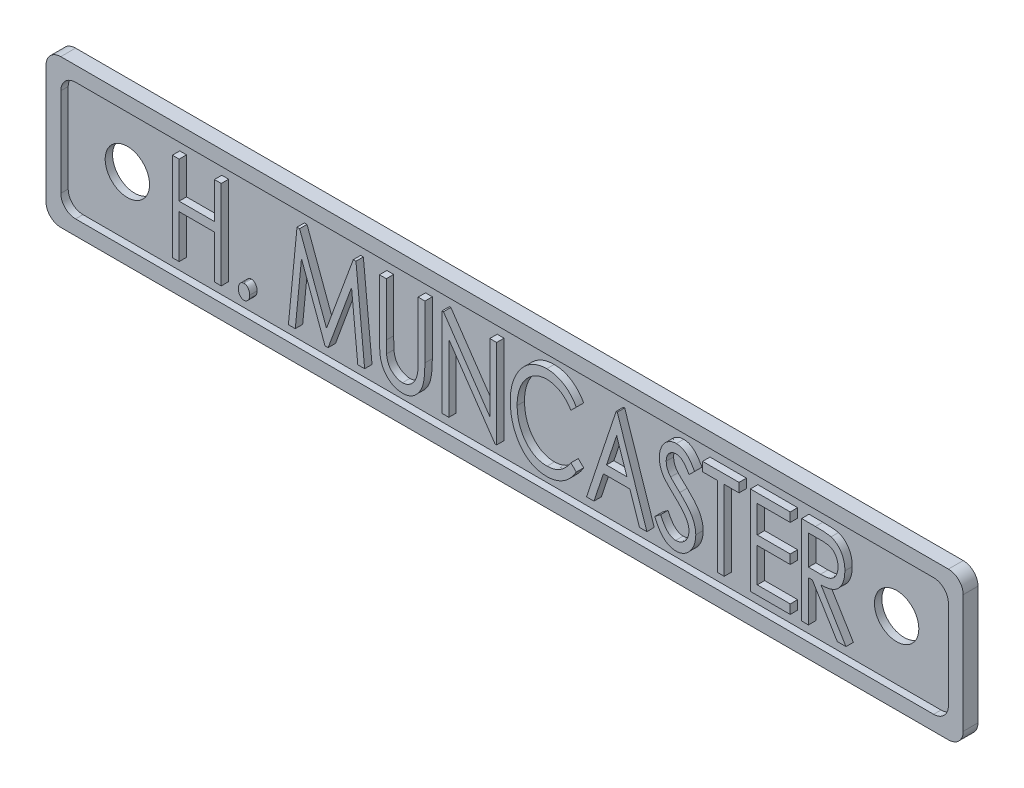
from build123d import *

# Parameters (mm, degrees)
SKETCH1_W           = 62
SKETCH1_H           = 10
BOSS_EXTRUDE1_DEPTH = 1
SKETCH2_W           = 60
SKETCH2_H           = 8
CUT_EXTRUDE2_DEPTH  = 0.5
FILLET1_R           = 1
SKETCH3_R           = 1.5
CUT_EXTRUDE3_DEPTH  = 32.404617495
BOSS_EXTRUDE2_DEPTH = 0.5


with BuildPart() as part:
    # Sketch1 → Boss-Extrude1 (new body)
    with BuildSketch(Plane.XY):
        Rectangle(SKETCH1_W, SKETCH1_H)
    extrude(amount=BOSS_EXTRUDE1_DEPTH)

    # Sketch2 → Cut-Extrude2 (cut)
    with BuildSketch(Plane.XY.offset(1)):
        Rectangle(SKETCH2_W, SKETCH2_H)
    extrude(amount=-CUT_EXTRUDE2_DEPTH, mode=Mode.SUBTRACT)

    # Fillet1
    fillet1_edges = [part.edges().sort_by_distance(p)[0] for p in [
        (-30, -4, 0.75),
        (-30, 4, 0.75),
        (30, 4, 0.75),
        (30, -4, 0.75),
        (31, -5, 0.5),
        (-31, -5, 0.5),
        (-31, 5, 0.5),
        (31, 5, 0.5),
    ]]
    fillet(fillet1_edges, radius=FILLET1_R)

    # Sketch3 → Cut-Extrude3 (cut, through all)
    with BuildSketch(Plane.XY.offset(0.5)):
        with Locations((-26, 0)):
            Circle(SKETCH3_R)
        with Locations((26, 0)):
            Circle(SKETCH3_R)
    extrude(amount=-CUT_EXTRUDE3_DEPTH, mode=Mode.SUBTRACT)

    # Sketch4 → Boss-Extrude2 (add)
    # profile 1 of 11: a face of its own
    with BuildSketch(Plane.XY.offset(0.5)):
        Polygon((-22.461538462, 3), (-22, 3), (-22, 0.538461538), (-19.615384615, 0.538461538), (-19.615384615, 3), (-19.153846154, 3), (-19.153846154, -3), (-19.615384615, -3), (-19.615384615, -0.076923077), (-22, -0.076923077), (-22, -3), (-22.461538462, -3), align=None)
    # profile 2 of 11: a face of its own
    with BuildSketch(Plane.XY.offset(0.5)):
        with BuildLine():
            add(Edge.make_bspline(
                [(-17.615384615, -2.076923077), (-17.589523185, -2.078902905), (-17.538413725, -2.082815602), (-17.464748755, -2.110549271), (-17.39885129, -2.158171278), (-17.340759852, -2.222042391), (-17.292381222, -2.298212427), (-17.255082191, -2.383449815), (-17.234973259, -2.477844229), (-17.232200947, -2.543180967), (-17.230769231, -2.576923077)],
                knots=[0, 0, 0, 0, 0.888235515, 1.755403159, 2.664739847, 3.658771767, 4.705496901, 5.754303631, 6.840246125, 8, 8, 8, 8], degree=3))
            add(Edge.make_bspline(
                [(-17.230769231, -2.576923077), (-17.232254955, -2.609856645), (-17.2351656, -2.674375934), (-17.255021795, -2.768027162), (-17.29272864, -2.853415577), (-17.34037106, -2.930423423), (-17.398845736, -2.994568624), (-17.465010677, -3.0417811), (-17.538137985, -3.071369126), (-17.589478624, -3.075060464), (-17.615384615, -3.076923077)],
                knots=[0, 0, 0, 0, 1.133833385, 2.221263238, 3.271506465, 4.33130329, 5.326696684, 6.237278843, 7.110547914, 8, 8, 8, 8], degree=3))
            add(Edge.make_bspline(
                [(-17.615384615, -3.076923077), (-17.641303381, -3.075078426), (-17.692669338, -3.071422686), (-17.765915396, -3.041441341), (-17.833068344, -2.995030779), (-17.891461073, -2.930320983), (-17.939555281, -2.853727008), (-17.975399848, -2.767709895), (-17.995705045, -2.674419681), (-17.998548548, -2.609871429), (-18, -2.576923077)],
                knots=[0, 0, 0, 0, 0.888790314, 1.761409654, 2.682617918, 3.677270718, 4.73627903, 5.78038943, 6.867010211, 8, 8, 8, 8], degree=3))
            add(Edge.make_bspline(
                [(-18, -2.576923077), (-17.998603819, -2.543165638), (-17.995900314, -2.47779922), (-17.975339373, -2.383767098), (-17.939896786, -2.297903738), (-17.891073182, -2.222143956), (-17.833063326, -2.157709118), (-17.766180246, -2.110882317), (-17.692393737, -2.082761588), (-17.641258892, -2.078884757), (-17.615384615, -2.076923077)],
                knots=[0, 0, 0, 0, 1.158892172, 2.244027806, 3.286711158, 4.33265857, 5.32595192, 6.245901114, 7.112424448, 8, 8, 8, 8], degree=3))
        make_face()
    # profile 3 of 11: a face of its own
    with BuildSketch(Plane.XY.offset(0.5)):
        Polygon((-14.615384615, -3), (-14.032451923, 3), (-13.858173077, 3), (-12.038461538, -1.923076923), (-10.229567308, 3), (-10.048076923, 3), (-9.461538462, -3), (-9.924278846, -3), (-10.346153846, 1.307692308), (-11.927884615, -3), (-12.139423077, -3), (-13.730769231, 1.307692308), (-14.149038462, -3), align=None)
    # profile 4 of 11: a face of its own
    with BuildSketch(Plane.XY.offset(0.5)):
        with BuildLine():
            Line((-8.461538462, 3), (-8, 3))
            Line((-8, 3), (-8, -0.594951923))
            add(Edge.make_bspline(
                [(-8, -0.594951923), (-8.000137495, -0.645834144), (-8.000398416, -0.742391927), (-7.998655639, -0.879805245), (-7.998137006, -1.002019622), (-7.99512821, -1.109370744), (-7.993503517, -1.201566002), (-7.989274728, -1.27884447), (-7.98662248, -1.341061559), (-7.982527713, -1.3774164), (-7.980769231, -1.393028846)],
                knots=[0, 0, 0, 0, 1.529155413, 2.901835916, 4.130035505, 5.201918895, 6.129357308, 6.900801451, 7.527953438, 8, 8, 8, 8], degree=3))
            add(Edge.make_bspline(
                [(-7.980769231, -1.393028846), (-7.974178758, -1.449279787), (-7.961420618, -1.558172948), (-7.926355429, -1.71304453), (-7.88078902, -1.854178607), (-7.823474755, -1.982212702), (-7.749339971, -2.09757866), (-7.66021953, -2.202984272), (-7.552331475, -2.296944374), (-7.431939254, -2.381338153), (-7.301612345, -2.449755674), (-7.168784847, -2.501181563), (-7.035153432, -2.533002518), (-6.945676503, -2.53665559), (-6.901442308, -2.538461538)],
                knots=[0, 0, 0, 0, 1.17424895, 2.273165188, 3.287688819, 4.247239277, 5.174089139, 6.123362021, 7.100708873, 8.13362008, 9.16716642, 10.145784664, 11.083342199, 12, 12, 12, 12], degree=3))
            add(Edge.make_bspline(
                [(-6.901442308, -2.538461538), (-6.8632915, -2.536600844), (-6.786732183, -2.532866888), (-6.673041068, -2.51006617), (-6.562996497, -2.468985143), (-6.455369113, -2.415309392), (-6.354681143, -2.345686788), (-6.260493786, -2.264433995), (-6.176764107, -2.169949747), (-6.100579167, -2.064564295), (-6.032296085, -1.947571639), (-5.977648421, -1.817143176), (-5.927538315, -1.676866468), (-5.905565237, -1.577631242), (-5.894230769, -1.526442308)],
                knots=[0, 0, 0, 0, 0.887425244, 1.780844861, 2.682628156, 3.611715659, 4.570365192, 5.521242685, 6.497608697, 7.498294315, 8.541734898, 9.639015203, 10.782123018, 12, 12, 12, 12], degree=3))
            add(Edge.make_bspline(
                [(-5.894230769, -1.526442308), (-5.890532745, -1.505225969), (-5.882252611, -1.457721106), (-5.870823297, -1.378508585), (-5.865456572, -1.284040949), (-5.856896475, -1.175193637), (-5.853587773, -1.051270492), (-5.847287465, -0.912314967), (-5.847648464, -0.758405521), (-5.846666705, -0.651038854), (-5.846153846, -0.594951923)],
                knots=[0, 0, 0, 0, 0.553535321, 1.239404254, 2.05518318, 2.983939725, 4.045295254, 5.240417841, 6.558430678, 8, 8, 8, 8], degree=3))
            Line((-5.846153846, -0.594951923), (-5.846153846, 3))
            Line((-5.846153846, 3), (-5.384615385, 3))
            Line((-5.384615385, 3), (-5.384615385, -0.623798077))
            add(Edge.make_bspline(
                [(-5.384615385, -0.623798077), (-5.38528543, -0.689103398), (-5.386592798, -0.816524872), (-5.390706739, -1.003310098), (-5.40053154, -1.180434271), (-5.413770468, -1.347940148), (-5.429842012, -1.505625441), (-5.452453668, -1.653675146), (-5.475228042, -1.792762014), (-5.513587996, -1.963278499), (-5.575515123, -2.164765659), (-5.684005206, -2.390209525), (-5.822657153, -2.599595214), (-5.960080099, -2.759638646), (-6.08446528, -2.873404912), (-6.183437428, -2.948264791), (-6.286950676, -3.012484522), (-6.395739817, -3.064585564), (-6.509237604, -3.103863151), (-6.626944492, -3.133464539), (-6.749921372, -3.150150635), (-6.833686184, -3.152601958), (-6.876201923, -3.153846154)],
                knots=[0, 0, 0, 0, 1.189495296, 2.320901874, 3.402429694, 4.419879292, 5.381225388, 6.288312168, 7.147249289, 7.947424288, 9.470551633, 10.975160932, 12.486972232, 14.033533548, 14.803182079, 15.553316057, 16.290454294, 17.018287978, 17.745243254, 18.474392565, 19.22566139, 20, 20, 20, 20], degree=3))
            add(Edge.make_bspline(
                [(-6.876201923, -3.153846154), (-6.922310733, -3.152512708), (-7.012788636, -3.149896129), (-7.146504518, -3.134526276), (-7.274502105, -3.10632353), (-7.398555728, -3.069726332), (-7.516127199, -3.019332597), (-7.630249214, -2.961303818), (-7.737044111, -2.888690022), (-7.840589424, -2.809252733), (-7.936150502, -2.718912232), (-8.024403917, -2.621400746), (-8.103728743, -2.516003243), (-8.176131723, -2.40480951), (-8.238805867, -2.285384684), (-8.294153074, -2.159932324), (-8.339881568, -2.026608737), (-8.363961059, -1.934861218), (-8.376201923, -1.888221154)],
                knots=[0, 0, 0, 0, 1.040046564, 2.040851474, 3.029716458, 3.992945491, 4.952778378, 5.910567797, 6.875363504, 7.860382118, 8.851185287, 9.836411077, 10.823085881, 11.82307474, 12.825469039, 13.861228841, 14.912750729, 16, 16, 16, 16], degree=3))
            add(Edge.make_bspline(
                [(-8.376201923, -1.888221154), (-8.383450837, -1.856251541), (-8.399210765, -1.78674612), (-8.4147017, -1.672108701), (-8.429106965, -1.540262589), (-8.440907694, -1.390743312), (-8.450239523, -1.224033241), (-8.457706267, -1.039724576), (-8.460816331, -0.837751411), (-8.461291001, -0.69711583), (-8.461538462, -0.623798077)],
                knots=[0, 0, 0, 0, 0.619449711, 1.346751184, 2.18483435, 3.12705977, 4.181588362, 5.341301494, 6.613936809, 8, 8, 8, 8], degree=3))
            Line((-8.461538462, -0.623798077), (-8.461538462, 3))
        make_face()
    # profile 5 of 11: a face of its own
    with BuildSketch(Plane.XY.offset(0.5)):
        Polygon((-4.230769231, -3), (-4.230769231, 3), (-4.133413462, 3), (-1, -1.575721154), (-1, 3), (-0.538461538, 3), (-0.538461538, -3), (-0.643028846, -3), (-3.769230769, 1.563701923), (-3.769230769, -3), align=None)
    # profile 6 of 11: a face of its own
    with BuildSketch(Plane.XY.offset(0.5)):
        with BuildLine():
            Line((4.846153846, 1.899038462), (4.480769231, 1.538461538))
            add(Edge.make_bspline(
                [(4.480769231, 1.538461538), (4.429931322, 1.616561786), (4.3308393, 1.768792902), (4.158110639, 1.972241305), (3.968988292, 2.144505444), (3.766301532, 2.287134283), (3.55137635, 2.400553458), (3.324082284, 2.479812403), (3.086740523, 2.530095581), (2.924530278, 2.535652854), (2.842548077, 2.538461538)],
                knots=[0, 0, 0, 0, 1.111525425, 2.166558491, 3.175351395, 4.157123073, 5.11752335, 6.065846558, 7.022465223, 8, 8, 8, 8], degree=3))
            add(Edge.make_bspline(
                [(2.842548077, 2.538461538), (2.797212982, 2.537774402), (2.707020468, 2.53640737), (2.573355511, 2.518121748), (2.442120014, 2.492503193), (2.313604234, 2.454512697), (2.187934147, 2.406503418), (2.063840468, 2.348447678), (1.943323714, 2.278585488), (1.825336308, 2.19949288), (1.71294198, 2.110515496), (1.605840877, 2.014112162), (1.50447161, 1.911364627), (1.412069376, 1.799229561), (1.323845773, 1.68206814), (1.243173522, 1.556085289), (1.169021304, 1.423186808), (1.101583117, 1.283514123), (1.041889112, 1.138072662), (0.98849271, 0.988393345), (0.945492549, 0.833133876), (0.909724333, 0.673833973), (0.880549111, 0.510281183), (0.860214225, 0.34216998), (0.847940135, 0.169658553), (0.846752921, 0.052904904), (0.846153846, -0.006009615)],
                knots=[0, 0, 0, 0, 0.907615735, 1.805668338, 2.698251542, 3.584750363, 4.486668963, 5.391547429, 6.326439657, 7.274845802, 8.235134492, 9.19572507, 10.160699102, 11.123701377, 12.104602389, 13.09764599, 14.118208251, 15.152161779, 16.20308195, 17.26679937, 18.334114781, 19.428523801, 20.537059719, 21.661122186, 22.819789684, 24, 24, 24, 24], degree=3))
            add(Edge.make_bspline(
                [(0.846153846, -0.006009615), (0.847448527, -0.094639647), (0.849986004, -0.268347877), (0.879369803, -0.522871973), (0.922180588, -0.766502418), (0.987307935, -0.998375634), (1.066883647, -1.220102237), (1.16629433, -1.430335383), (1.282887633, -1.629393357), (1.417076772, -1.814446736), (1.563860333, -1.983892322), (1.722273027, -2.132225304), (1.891040135, -2.257334297), (2.068276401, -2.360126455), (2.255334436, -2.440826423), (2.452232418, -2.496267655), (2.658070221, -2.533244942), (2.798713371, -2.536703698), (2.870192308, -2.538461538)],
                knots=[0, 0, 0, 0, 1.176544319, 2.305938824, 3.398675503, 4.458528894, 5.500492725, 6.524019327, 7.54247104, 8.560018829, 9.555640471, 10.515690316, 11.436249321, 12.339796262, 13.231324186, 14.133993287, 15.051641147, 16, 16, 16, 16], degree=3))
            add(Edge.make_bspline(
                [(2.870192308, -2.538461538), (2.948958689, -2.535547666), (3.104715858, -2.529785606), (3.332997247, -2.481006923), (3.551459921, -2.402373868), (3.759782598, -2.291813862), (3.9571635, -2.14914771), (4.143937844, -1.975378831), (4.321884979, -1.771220961), (4.426641212, -1.61775704), (4.480769231, -1.538461538)],
                knots=[0, 0, 0, 0, 0.952744079, 1.884010888, 2.812241363, 3.756054432, 4.729234272, 5.752103472, 6.83850172, 8, 8, 8, 8], degree=3))
            Line((4.480769231, -1.538461538), (4.846153846, -1.895432692))
            add(Edge.make_bspline(
                [(4.846153846, -1.895432692), (4.817435647, -1.944238724), (4.76047853, -2.041036259), (4.66688777, -2.178651707), (4.568009542, -2.30773199), (4.464147929, -2.428587047), (4.355355923, -2.541364137), (4.240539277, -2.645406886), (4.120189507, -2.740159049), (3.995319665, -2.827075786), (3.865915047, -2.903681306), (3.732620703, -2.97049546), (3.595508241, -3.026758164), (3.454745603, -3.074029998), (3.310059383, -3.110209365), (3.161327842, -3.135017815), (3.009183426, -3.151433127), (2.906292828, -3.153038896), (2.854567308, -3.153846154)],
                knots=[0, 0, 0, 0, 1.097466587, 2.176617458, 3.223542499, 4.24784203, 5.263894416, 6.259075414, 7.248787007, 8.231127996, 9.20607359, 10.161176055, 11.11880108, 12.076583544, 13.037195505, 14.006246386, 14.997693222, 16, 16, 16, 16], degree=3))
            add(Edge.make_bspline(
                [(2.854567308, -3.153846154), (2.805250995, -3.153393918), (2.707633851, -3.152498758), (2.563676577, -3.138118673), (2.423446123, -3.118431756), (2.287628084, -3.088832873), (2.154920694, -3.053955194), (2.027216003, -3.006742792), (1.902355729, -2.955240052), (1.782485485, -2.89254157), (1.665973676, -2.823496092), (1.55381454, -2.744736652), (1.445835865, -2.657976953), (1.340778761, -2.564023388), (1.23978061, -2.461892497), (1.14350397, -2.351038074), (1.051954552, -2.231288775), (0.994418188, -2.147300001), (0.965144231, -2.104567308)],
                knots=[0, 0, 0, 0, 1.046396854, 2.071247165, 3.068337592, 4.050812492, 5.020504577, 5.978187628, 6.938585804, 7.885712413, 8.846901056, 9.811882422, 10.792109303, 11.785857194, 12.802202964, 13.839086606, 14.90054771, 16, 16, 16, 16], degree=3))
            add(Edge.make_bspline(
                [(0.965144231, -2.104567308), (0.918541385, -2.029597556), (0.824993365, -1.87910735), (0.708280504, -1.638687561), (0.607759495, -1.387786621), (0.526335945, -1.12522486), (0.462546092, -0.851283965), (0.416943159, -0.566172703), (0.390546358, -0.269330136), (0.386616184, -0.067760604), (0.384615385, 0.034855769)],
                knots=[0, 0, 0, 0, 0.941762336, 1.890442552, 2.848217964, 3.824856944, 4.82179242, 5.84833146, 6.904614102, 8, 8, 8, 8], degree=3))
            add(Edge.make_bspline(
                [(0.384615385, 0.034855769), (0.386460088, 0.142730192), (0.390083455, 0.354617137), (0.425490568, 0.665389179), (0.478168597, 0.963555323), (0.555733534, 1.24806321), (0.654241253, 1.520218061), (0.775984001, 1.778539997), (0.91859145, 2.024634672), (1.082086034, 2.254643762), (1.261561486, 2.465035875), (1.454459805, 2.649364571), (1.659529168, 2.804659843), (1.875158821, 2.933161365), (2.102889696, 3.032686644), (2.341668008, 3.102133671), (2.5913582, 3.145732602), (2.761838287, 3.151110525), (2.848557692, 3.153846154)],
                knots=[0, 0, 0, 0, 1.169859921, 2.297838878, 3.38909346, 4.451914606, 5.49279678, 6.52526877, 7.545842673, 8.574575139, 9.582520364, 10.541746408, 11.463212457, 12.367418115, 13.258904221, 14.15150219, 15.059710529, 16, 16, 16, 16], degree=3))
            add(Edge.make_bspline(
                [(2.848557692, 3.153846154), (2.901080829, 3.153024907), (3.005164255, 3.151397468), (3.159424939, 3.135271791), (3.309593304, 3.108928089), (3.455999208, 3.072256119), (3.59928106, 3.027589922), (3.737412026, 2.969135046), (3.871637051, 2.901172023), (4.002515952, 2.824704471), (4.128435584, 2.73809138), (4.248972221, 2.643011346), (4.362964348, 2.53936659), (4.472073473, 2.428104533), (4.574905008, 2.308493159), (4.671652854, 2.179775145), (4.76290522, 2.043409118), (4.818242825, 1.947442053), (4.846153846, 1.899038462)],
                knots=[0, 0, 0, 0, 1.015828107, 2.013034202, 2.996775397, 3.9630177, 4.931247519, 5.897116707, 6.860744174, 7.840446603, 8.827236464, 9.81499991, 10.808221994, 11.805759373, 12.828042674, 13.85735367, 14.919298219, 16, 16, 16, 16], degree=3))
        make_face()
    # profile 7 of 11: a face of its own
    with BuildSketch(Plane.XY.offset(0.5)):
        Polygon((7.615384615, 3), (9.615384615, -3), (9.112980769, -3), (8.472355769, -1.076923077), (6.681490385, -1.076923077), (6.040865385, -3), (5.538461538, -3), (7.538461538, 3), align=None)
        Polygon((7.576923077, 1.608173077), (6.887019231, -0.461538462), (8.266826923, -0.461538462), align=None, mode=Mode.SUBTRACT)
    # profile 8 of 11: a face of its own
    with BuildSketch(Plane.XY.offset(0.5)):
        with BuildLine():
            Line((10.153846154, -1.842548077), (10.548076923, -1.538461538))
            add(Edge.make_bspline(
                [(10.548076923, -1.538461538), (10.584196754, -1.61715141), (10.652811988, -1.766635053), (10.768187005, -1.970960886), (10.887905727, -2.144551544), (11.012953708, -2.286762579), (11.142161445, -2.398662125), (11.276339259, -2.479028342), (11.416385395, -2.529380901), (11.51242981, -2.53544965), (11.560096154, -2.538461538)],
                knots=[0, 0, 0, 0, 1.383911973, 2.628955942, 3.746738872, 4.749501891, 5.649278085, 6.467738257, 7.239546467, 8, 8, 8, 8], degree=3))
            add(Edge.make_bspline(
                [(11.560096154, -2.538461538), (11.60031061, -2.536944344), (11.680817483, -2.533907013), (11.798990083, -2.506105661), (11.913722476, -2.462585888), (12.022077261, -2.401041146), (12.123338479, -2.325789556), (12.212288578, -2.236308635), (12.289169897, -2.135527194), (12.351169763, -2.023363672), (12.39968046, -1.903637435), (12.436512332, -1.779850019), (12.457153373, -1.65173338), (12.460064171, -1.565374532), (12.461538462, -1.521634615)],
                knots=[0, 0, 0, 0, 0.957025484, 1.915906269, 2.876875915, 3.872777538, 4.875201359, 5.874300986, 6.869103784, 7.886329657, 8.918145261, 9.94233607, 10.957813246, 12, 12, 12, 12], degree=3))
            add(Edge.make_bspline(
                [(12.461538462, -1.521634615), (12.459202698, -1.471822319), (12.454490422, -1.37132875), (12.423919319, -1.221837166), (12.371355036, -1.074105587), (12.322115684, -0.980616129), (12.296875, -0.932692308)],
                knots=[0, 0, 0, 0, 0.966966069, 1.9508009, 2.949555883, 4, 4, 4, 4], degree=3))
            add(Edge.make_bspline(
                [(12.296875, -0.932692308), (12.276376695, -0.898429227), (12.233682171, -0.827064989), (12.159961585, -0.719512024), (12.072446985, -0.60854705), (11.976003151, -0.49033056), (11.865313453, -0.369540021), (11.745586787, -0.241259114), (11.611966784, -0.109928379), (11.51818831, -0.021464357), (11.469951923, 0.024038462)],
                knots=[0, 0, 0, 0, 0.755051921, 1.572646229, 2.463860742, 3.427272442, 4.457417882, 5.561650114, 6.745797563, 8, 8, 8, 8], degree=3))
            add(Edge.make_bspline(
                [(11.469951923, 0.024038462), (11.421647043, 0.069072626), (11.328994379, 0.155451792), (11.199949066, 0.282882643), (11.084033478, 0.399368072), (10.982695679, 0.506084421), (10.896667695, 0.60388404), (10.821972902, 0.689544956), (10.764398476, 0.767835995), (10.732171188, 0.81757513), (10.717548077, 0.840144231)],
                knots=[0, 0, 0, 0, 1.424520873, 2.732346164, 3.911797783, 4.969453705, 5.906063081, 6.721610001, 7.419931359, 8, 8, 8, 8], degree=3))
            add(Edge.make_bspline(
                [(10.717548077, 0.840144231), (10.678173932, 0.910874382), (10.600026302, 1.051255682), (10.520696599, 1.278112419), (10.469843847, 1.512949587), (10.464326851, 1.672809616), (10.461538462, 1.753605769)],
                knots=[0, 0, 0, 0, 1.010002809, 2.004597808, 2.991487604, 4, 4, 4, 4], degree=3))
            add(Edge.make_bspline(
                [(10.461538462, 1.753605769), (10.463420897, 1.817009533), (10.467132555, 1.942024742), (10.4954085, 2.12496143), (10.540846367, 2.299721372), (10.6054957, 2.463977502), (10.687438606, 2.615352621), (10.782718971, 2.752832067), (10.896919653, 2.870181018), (11.022171002, 2.971598294), (11.159477152, 3.051670677), (11.302870763, 3.112104818), (11.453534866, 3.146409995), (11.555526101, 3.151352913), (11.606971154, 3.153846154)],
                knots=[0, 0, 0, 0, 1.134028395, 2.235999694, 3.303558056, 4.359136636, 5.385468439, 6.377922891, 7.341187669, 8.305065693, 9.252924554, 10.175426404, 11.07967301, 12, 12, 12, 12], degree=3))
            add(Edge.make_bspline(
                [(11.606971154, 3.153846154), (11.662112625, 3.151425898), (11.771941237, 3.146605328), (11.933065173, 3.103663898), (12.087304275, 3.03351581), (12.21077971, 2.954537631), (12.306830259, 2.875259006), (12.381819821, 2.804376199), (12.455603097, 2.720180319), (12.53328214, 2.627098074), (12.609176739, 2.520203541), (12.689285706, 2.404191354), (12.767953663, 2.275169127), (12.819541395, 2.184826175), (12.846153846, 2.138221154)],
                knots=[0, 0, 0, 0, 1.175486554, 2.34128787, 3.531861235, 4.78213163, 5.45670903, 6.188699625, 6.982072091, 7.845002107, 8.775633155, 9.779069424, 10.854293392, 12, 12, 12, 12], degree=3))
            Line((12.846153846, 2.138221154), (12.467548077, 1.769230769))
            add(Edge.make_bspline(
                [(12.467548077, 1.769230769), (12.445859778, 1.807101782), (12.404117283, 1.879990418), (12.338427767, 1.981620917), (12.277806548, 2.074519662), (12.218774824, 2.156992284), (12.161046541, 2.228559433), (12.107077926, 2.291601354), (12.055923386, 2.344937228), (11.990411201, 2.400495524), (11.908406218, 2.456016731), (11.804656712, 2.504047977), (11.696234584, 2.532646717), (11.62235912, 2.536520299), (11.585336538, 2.538461538)],
                knots=[0, 0, 0, 0, 1.277082512, 2.457943285, 3.540954167, 4.523791102, 5.424804978, 6.231190945, 6.952616042, 7.584745617, 8.7425584, 9.83919577, 10.917116091, 12, 12, 12, 12], degree=3))
            add(Edge.make_bspline(
                [(11.585336538, 2.538461538), (11.53850119, 2.536313647), (11.447178147, 2.532125529), (11.318105477, 2.487787522), (11.202857829, 2.417148289), (11.104354492, 2.32074856), (11.023671383, 2.205258616), (10.96543582, 2.074315432), (10.929716144, 1.93056356), (10.925330238, 1.830338214), (10.923076923, 1.778846154)],
                knots=[0, 0, 0, 0, 0.99611477, 1.942298585, 2.874789164, 3.86028234, 4.861081634, 5.863631982, 6.902413458, 8, 8, 8, 8], degree=3))
            add(Edge.make_bspline(
                [(10.923076923, 1.778846154), (10.926593813, 1.714897222), (10.933637793, 1.586813884), (10.974395913, 1.428558772), (11.027551569, 1.304545017), (11.079451991, 1.206355618), (11.146489215, 1.105369134), (11.197888106, 1.038542798), (11.224759615, 1.003605769)],
                knots=[0, 0, 0, 0, 1.355548403, 2.715028404, 3.434297335, 4.213120542, 5.065813534, 6, 6, 6, 6], degree=3))
            add(Edge.make_bspline(
                [(11.224759615, 1.003605769), (11.234628004, 0.99185234), (11.258166256, 0.963817859), (11.303189664, 0.919356003), (11.360218318, 0.861826149), (11.430553573, 0.793128438), (11.513539402, 0.711815495), (11.611416113, 0.621031017), (11.721832846, 0.517498213), (11.800055322, 0.444685312), (11.841346154, 0.40625)],
                knots=[0, 0, 0, 0, 0.428692003, 1.022523547, 1.766726267, 2.693054975, 3.769890224, 5.013497286, 6.423532597, 8, 8, 8, 8], degree=3))
            add(Edge.make_bspline(
                [(11.841346154, 0.40625), (11.891239461, 0.358797393), (11.988142063, 0.26663511), (12.125695564, 0.12877509), (12.249546361, -0.006670294), (12.362673809, -0.136626496), (12.462715788, -0.263814512), (12.552270438, -0.385620318), (12.628269646, -0.505042742), (12.712057411, -0.656990556), (12.796245895, -0.844976006), (12.869182858, -1.072591181), (12.914573261, -1.30107922), (12.920257344, -1.454128342), (12.923076923, -1.530048077)],
                knots=[0, 0, 0, 0, 1.084434174, 2.106184132, 3.066299982, 3.974504037, 4.819036384, 5.614179407, 6.354614465, 7.046545079, 8.345825613, 9.591028967, 10.805034351, 12, 12, 12, 12], degree=3))
            add(Edge.make_bspline(
                [(12.923076923, -1.530048077), (12.921907715, -1.583776281), (12.919597469, -1.689938207), (12.901698589, -1.846522538), (12.86957233, -1.99732187), (12.828192367, -2.143752174), (12.772463838, -2.284350781), (12.705064948, -2.419579898), (12.624951706, -2.548765826), (12.534838036, -2.671248161), (12.435804024, -2.783788118), (12.330087723, -2.883192586), (12.218036893, -2.966134845), (12.101330464, -3.034656264), (11.979037492, -3.087857568), (11.851255607, -3.126420247), (11.718025706, -3.150081939), (11.627500393, -3.152582081), (11.581730769, -3.153846154)],
                knots=[0, 0, 0, 0, 1.104469644, 2.182329142, 3.233937398, 4.27141944, 5.306905159, 6.338287977, 7.373773695, 8.428087969, 9.460949709, 10.451670126, 11.405478766, 12.320888455, 13.22829632, 14.140290566, 15.059730392, 16, 16, 16, 16], degree=3))
            add(Edge.make_bspline(
                [(11.581730769, -3.153846154), (11.546418072, -3.152953137), (11.475899779, -3.151169813), (11.371861107, -3.135868842), (11.269621886, -3.113869485), (11.170893248, -3.078853878), (11.07338981, -3.037650537), (10.979124102, -2.985142272), (10.887519384, -2.923567058), (10.798091004, -2.852237537), (10.710618592, -2.769627418), (10.625915833, -2.674079263), (10.540990307, -2.56748701), (10.461622191, -2.445774605), (10.380123567, -2.314046694), (10.303084937, -2.167991594), (10.225261924, -2.010612199), (10.17812927, -1.899694007), (10.153846154, -1.842548077)],
                knots=[0, 0, 0, 0, 0.820449022, 1.638409663, 2.440521417, 3.24753877, 4.069361106, 4.898905185, 5.751347498, 6.632806319, 7.555188638, 8.544456245, 9.599041491, 10.720130119, 11.919714617, 13.198980023, 14.556892339, 16, 16, 16, 16], degree=3))
        make_face()
    # profile 9 of 11: a face of its own
    with BuildSketch(Plane.XY.offset(0.5)):
        Polygon((13.384615385, 2.384615385), (13.384615385, 3), (15.846153846, 3), (15.846153846, 2.384615385), (14.846153846, 2.384615385), (14.846153846, -3), (14.384615385, -3), (14.384615385, 2.384615385), align=None)
    # profile 10 of 11: a face of its own
    with BuildSketch(Plane.XY.offset(0.5)):
        Polygon((16.615384615, 3), (19.307692308, 3), (19.307692308, 2.384615385), (17.076923077, 2.384615385), (17.076923077, 0.538461538), (19.307692308, 0.538461538), (19.307692308, -0.076923077), (17.076923077, -0.076923077), (17.076923077, -2.384615385), (19.307692308, -2.384615385), (19.307692308, -3), (16.615384615, -3), align=None)
    # profile 11 of 11: a face of its own
    with BuildSketch(Plane.XY.offset(0.5)):
        with BuildLine():
            Line((20.076923077, 3), (21.008413462, 3))
            add(Edge.make_bspline(
                [(21.008413462, 3), (21.070512309, 2.999739407), (21.189513223, 2.99924003), (21.360659509, 2.996303005), (21.516054556, 2.988241168), (21.656065, 2.98112552), (21.779770395, 2.968252346), (21.888240269, 2.956099977), (21.98104025, 2.939734308), (22.036934684, 2.925005828), (22.0625, 2.918269231)],
                knots=[0, 0, 0, 0, 1.406291012, 2.694895705, 3.875596585, 4.929939196, 5.86881668, 6.691431991, 7.401479668, 8, 8, 8, 8], degree=3))
            add(Edge.make_bspline(
                [(22.0625, 2.918269231), (22.096402168, 2.907317385), (22.164277265, 2.885390833), (22.261195077, 2.840666397), (22.353273811, 2.786915549), (22.441506829, 2.726191192), (22.523267522, 2.654408024), (22.600283497, 2.574376624), (22.67435529, 2.486972179), (22.740382233, 2.389464403), (22.802664123, 2.286340838), (22.8549611, 2.175741572), (22.899417117, 2.059487718), (22.937404714, 1.938135783), (22.964097186, 1.810363813), (22.984620834, 1.677189747), (22.998625091, 1.538357661), (22.999537177, 1.44354424), (23, 1.395432692)],
                knots=[0, 0, 0, 0, 0.890219086, 1.782296258, 2.662026138, 3.55410331, 4.45596999, 5.376940187, 6.329934089, 7.316405561, 8.318020235, 9.33962404, 10.370274173, 11.428642517, 12.515222745, 13.630246086, 14.797506457, 16, 16, 16, 16], degree=3))
            add(Edge.make_bspline(
                [(23, 1.395432692), (22.998150067, 1.315578002), (22.994553355, 1.160321363), (22.960105156, 0.93492605), (22.903946176, 0.724192299), (22.824939882, 0.529420861), (22.725392266, 0.353455219), (22.606878375, 0.19787931), (22.466726355, 0.067113588), (22.334701593, -0.023729806), (22.217802892, -0.082060629), (22.122763996, -0.122662383), (22.018813923, -0.153911599), (21.907902155, -0.182177508), (21.788580351, -0.203448013), (21.661377768, -0.218803828), (21.526192121, -0.228601155), (21.43351072, -0.23003261), (21.385817308, -0.230769231)],
                knots=[0, 0, 0, 0, 1.463301985, 2.845009436, 4.168980889, 5.453965417, 6.687638921, 7.866010869, 9.024897383, 10.188268473, 10.789455717, 11.41836669, 12.080505235, 12.777114878, 13.516268487, 14.300753823, 15.125575917, 16, 16, 16, 16], degree=3))
            Line((21.385817308, -0.230769231), (23.076923077, -3))
            Line((23.076923077, -3), (22.489182692, -3))
            Line((22.489182692, -3), (20.798076923, -0.230769231))
            Line((20.798076923, -0.230769231), (20.538461538, -0.230769231))
            Line((20.538461538, -0.230769231), (20.538461538, -3))
            Line((20.538461538, -3), (20.076923077, -3))
            Line((20.076923077, -3), (20.076923077, 3))
        make_face()
        with BuildLine():
            Line((20.538461538, 2.384615385), (20.538461538, 0.384615385))
            Line((20.538461538, 0.384615385), (21.354567308, 0.376201923))
            add(Edge.make_bspline(
                [(21.354567308, 0.376201923), (21.428735842, 0.377496425), (21.56697885, 0.379909253), (21.759041233, 0.399398055), (21.920552322, 0.432596883), (22.054641895, 0.482231806), (22.165086716, 0.550299862), (22.262117497, 0.631741073), (22.344921533, 0.731486675), (22.414843688, 0.846159194), (22.468438707, 0.973012851), (22.511082845, 1.107440134), (22.532984003, 1.250088341), (22.536617335, 1.347294703), (22.538461538, 1.396634615)],
                knots=[0, 0, 0, 0, 1.484503796, 2.766972155, 3.858711607, 4.777707686, 5.612610321, 6.443380992, 7.3028828, 8.195570234, 9.122302869, 10.053363384, 11.011928053, 12, 12, 12, 12], degree=3))
            add(Edge.make_bspline(
                [(22.538461538, 1.396634615), (22.536779441, 1.444806472), (22.533463915, 1.539756448), (22.509164483, 1.678824318), (22.467977495, 1.810771697), (22.411524355, 1.934156971), (22.343220458, 2.046189681), (22.263033472, 2.143087615), (22.172225624, 2.222055419), (22.087117291, 2.273919303), (22.011308749, 2.305655178), (21.945977055, 2.327543416), (21.871505939, 2.345115754), (21.788313853, 2.35903563), (21.696966512, 2.371323816), (21.597079582, 2.379396661), (21.488432004, 2.384282627), (21.413066679, 2.384501396), (21.373798077, 2.384615385)],
                knots=[0, 0, 0, 0, 1.313944225, 2.589872584, 3.837965354, 5.075530782, 6.282894025, 7.408145269, 8.493011398, 9.552186356, 10.110521641, 10.732722405, 11.429993849, 12.195550865, 13.033463864, 13.943953869, 14.928710818, 16, 16, 16, 16], degree=3))
            Line((21.373798077, 2.384615385), (20.538461538, 2.384615385))
        make_face(mode=Mode.SUBTRACT)
    extrude(amount=BOSS_EXTRUDE2_DEPTH)


solid = part.part
